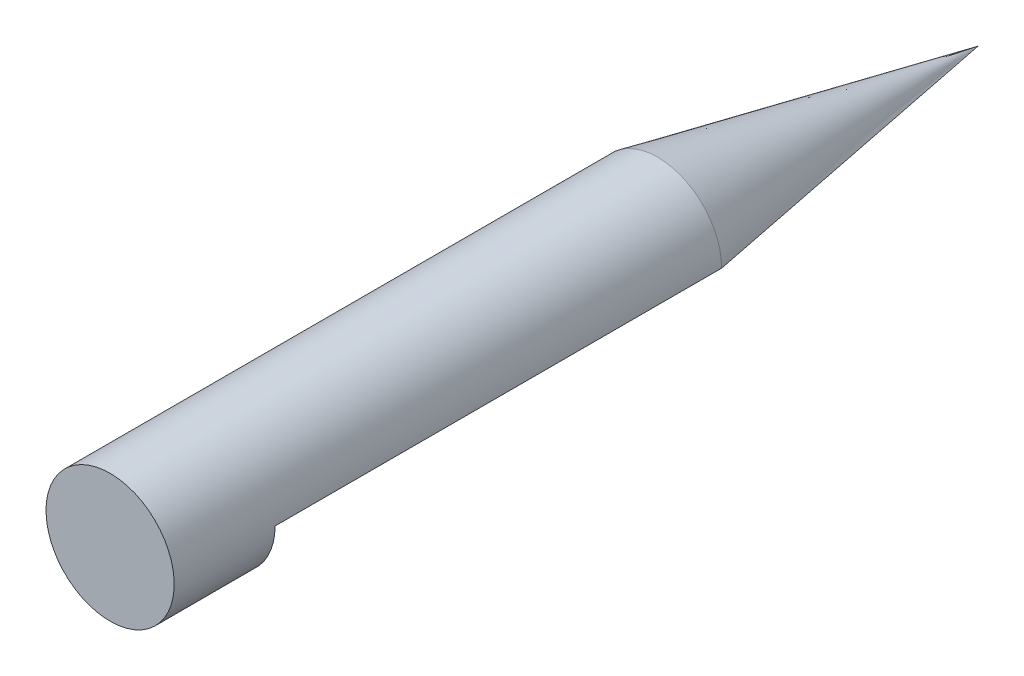
from build123d import *

# Parameters (mm, degrees)
CUT_EXTRUDE2_DEPTH = 40


with BuildPart() as part:
    # Sketch1 → Revolve1 (revolve)
    with BuildSketch(Plane.XZ, mode=Mode.PRIVATE) as revolve1_sk:
        Polygon((3.175, -2), (0, -2), (0, -45), (3.175, -29.125), align=None)
    revolve(revolve1_sk.sketch.rotate(Axis((0, 0, -2), (0, 0, -1)), 180), axis=Axis((0, 0, -2), (0, 0, -1)))

    # Sketch2 → Cut-Extrude2 (cut)
    with BuildSketch(Plane.XY.offset(-7)):
        with BuildLine():
            Line((3.175, 0), (-3.175, 0))
            ThreePointArc((-3.175, 0), (0, -3.175), (3.175, 0))
        make_face()
    extrude(amount=-CUT_EXTRUDE2_DEPTH, mode=Mode.SUBTRACT)


solid = part.part
